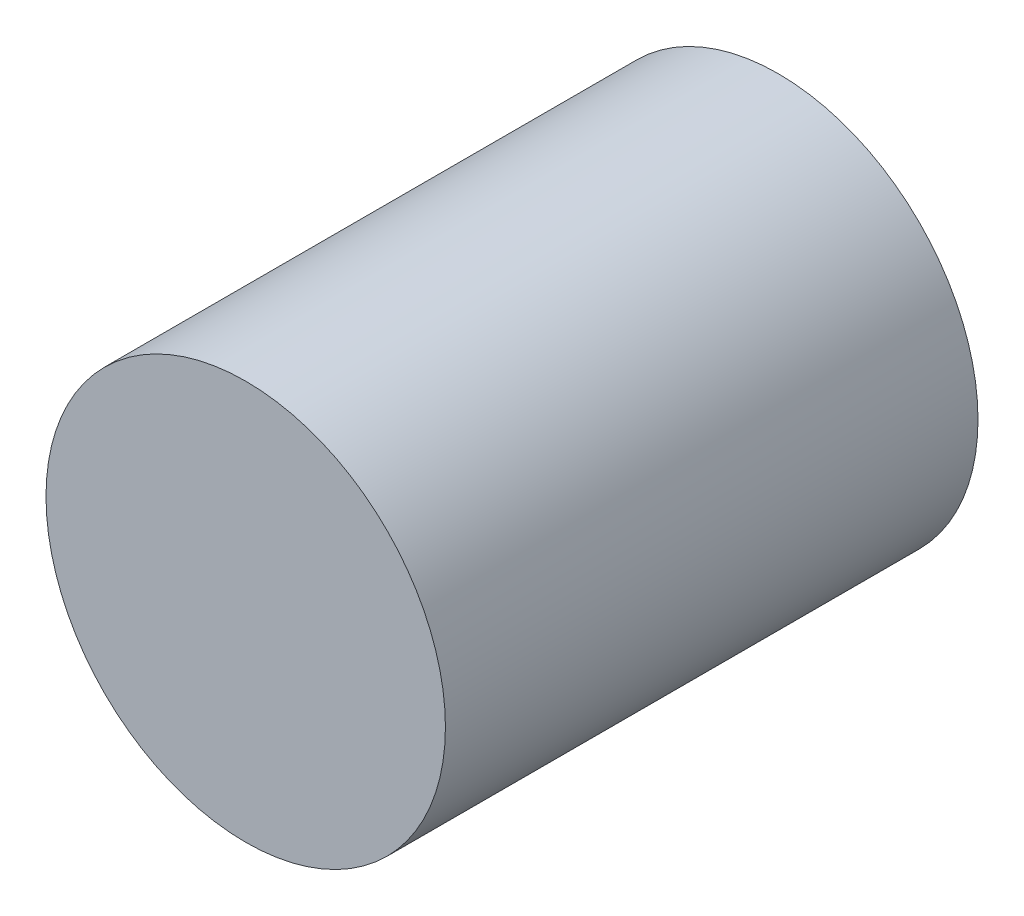
from build123d import *

# Parameters (mm, degrees)
SKETCH1_R           = 19.05
BOSS_EXTRUDE1_DEPTH = 50.8


with BuildPart() as part:
    # Sketch1 → Boss-Extrude1 (new body)
    with BuildSketch(Plane.XY):
        Circle(SKETCH1_R)
    extrude(amount=BOSS_EXTRUDE1_DEPTH)


solid = part.part
